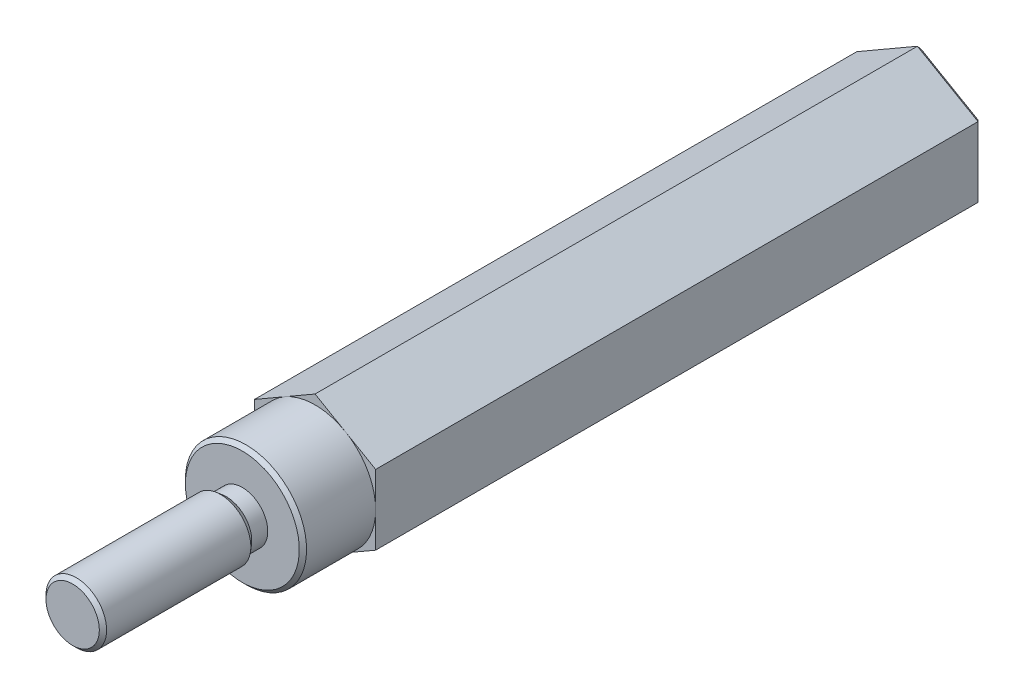
from build123d import *

# Parameters (mm, degrees)
AUFSATZ_LINEAR_AUSTRAGEN1_DEPTH = 70
FASE1_SIZE                      = 0.3
FASE2_SIZE                      = 0.3


with BuildPart() as part:
    # Skizze1 → Aufsatz-Linear austragen1 (new body)
    with BuildSketch(Plane.XY):
        Polygon((0, 5.773502692), (-5, 2.886751346), (-5, -2.886751346), (0, -5.773502692), (5, -2.886751346), (5, 2.886751346), align=None)
    extrude(amount=AUFSATZ_LINEAR_AUSTRAGEN1_DEPTH)

    # Skizze2 → Schnitt-Rotation1 (revolve, cut)
    with BuildSketch(Plane(origin=(0, 0, 0), x_dir=(0, 0, -1), z_dir=(1, 0, 0)), mode=Mode.PRIVATE) as schnitt_rotation1_sk:
        Polygon((-70, 2.5), (-56, 2.5), (-56, 5), (-50, 5), (-50, 7.5), (-70, 7.5), align=None)
    revolve(schnitt_rotation1_sk.sketch.rotate(Axis((0, 0, 56.716665977), (0, 0, 1)), 90), axis=Axis((0, 0, 56.716665977), (0, 0, 1)), mode=Mode.SUBTRACT)

    # Fase1
    fase1_edges = [part.edges().sort_by_distance(p)[0] for p in [
        (2.5, 0, 70),
        (5, 0, 56),
    ]]
    chamfer(fase1_edges, length=FASE1_SIZE)

    # Skizze3 → Schnitt-Rotation2 (revolve, cut)
    with BuildSketch(Plane(origin=(0, 0, 0), x_dir=(0, 0, -1), z_dir=(1, 0, 0)), mode=Mode.PRIVATE) as schnitt_rotation2_sk:
        Polygon((-56, 2.5), (-57.8, 2.5), (-57.323298563, 2.1), (-56, 2.1), align=None)
    revolve(schnitt_rotation2_sk.sketch.rotate(Axis((0, 0, 56), (0, 0, 1)), 90), axis=Axis((0, 0, 56), (0, 0, 1)), mode=Mode.SUBTRACT)

    # Fase2
    fase2_edges = [part.edges().sort_by_distance(p)[0] for p in [
        (5, 0, 0),
        (2.5, -4.330127019, 0),
        (-2.5, -4.330127019, 0),
        (-5, 0, 0),
        (-2.5, 4.330127019, 0),
        (2.5, 4.330127019, 0),
    ]]
    chamfer(fase2_edges, length=FASE2_SIZE)


solid = part.part
